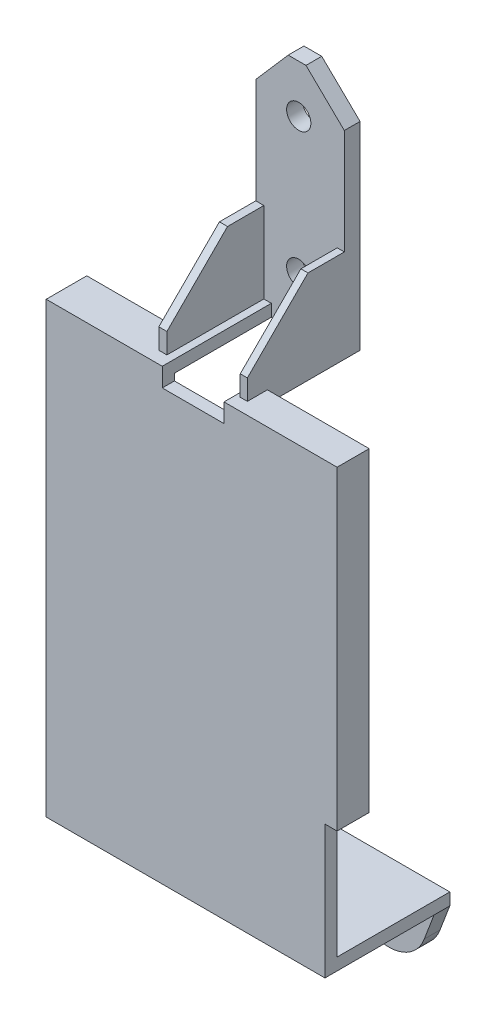
from build123d import *

# Parameters (mm, degrees)
ESQUISSE1_R             = 1
ESQUISSE1_RX            = 1
ESQUISSE1_RY            = 0.999955708
EXTRUSION1_DEPTH        = 9.3
EXTRUSION2_DEPTH        = 1
ENL_V_MAT_EXTRU_1_REACH = 53.345
ESQUISSE3_W             = 7.649288298
ESQUISSE3_H             = 26
ENL_V_MAT_EXTRU_2_REACH = 53.345
ESQUISSE4_W             = 6.951833508
ESQUISSE4_H             = 37
ENL_V_MAT_EXTRU_3_DEPTH = 9
CHANFREIN1_SIZE         = 5
ENL_V_MAT_EXTRU_4_DEPTH = 8


with BuildPart() as part:
    # Esquisse1 → Extrusion1 (new body)
    with BuildSketch(Plane.XY):
        with BuildLine():
            Line((22, 0), (22, 25))
            Line((22, 25), (0, 25))
            Line((0, 25), (0, -10))
            Line((0, -10), (22, -10))
            Line((22, -10), (22, -11))
            Line((22, -11), (21.190138404, -13.124684482))
            ThreePointArc((21.190138404, -13.124684482), (18.28157598, -15.158841298), (15.373013556, -13.124684482))
            Line((15.373013556, -13.124684482), (14.596979988, -11))
            Line((14.596979988, -11), (-1, -11))
            Line((-1, -11), (-1, 26))
            Line((-1, 26), (7.292692784, 26))
            Line((7.292692784, 26), (7.292692784, 41.355378005))
            Line((7.292692784, 41.355378005), (9.96388584, 44.427250018))
            Line((9.96388584, 44.427250018), (11.43304202, 44.427250018))
            Line((11.43304202, 44.427250018), (14.596979988, 41.355378005))
            Line((14.596979988, 41.355378005), (14.596979988, 26))
            Line((14.596979988, 26), (23, 26))
            Line((23, 26), (23, 0))
            Line((23, 0), (22, 0))
        make_face()
        with Locations((10.835624977, 29.282154136)):
            Circle(ESQUISSE1_R, mode=Mode.SUBTRACT)
        with Locations((10.835624977, 40.485887017)):
            Circle(ESQUISSE1_R, mode=Mode.SUBTRACT)
        with Locations(Location((18.28157598, -12.062342241), (0, 0, 0))):
            Ellipse(ESQUISSE1_RX, ESQUISSE1_RY, mode=Mode.SUBTRACT)
    extrude(amount=-EXTRUSION1_DEPTH)

    # Esquisse2 → Extrusion2 (add)
    with BuildSketch(Plane.XY):
        Polygon((22, 0), (23, 0), (23, 26), (-1, 26), (-1, -11), (22, -11), align=None)
    extrude(amount=EXTRUSION2_DEPTH)

    # Enlèv. mat.-Extru.1: up to this face of the body (flat: up to its plane)
    enl_v_mat_extru_1_end = Plane(part.part.faces().sort_by_distance((14.596979988, 33.677689002, -4.65))[0])
    # Esquisse3 → Enlèv. mat.-Extru.1 (cut, up to the picked face)
    with BuildSketch(Plane(origin=(23, 0, 0), x_dir=(0, 0, -1), z_dir=(1, 0, 0)), mode=Mode.PRIVATE) as enl_v_mat_extru_1_sk1:
        with Locations((5.475355851, 13)):
            Rectangle(ESQUISSE3_W, ESQUISSE3_H)
    enl_v_mat_extru_1_tool1 = split(extrude(enl_v_mat_extru_1_sk1.sketch, amount=-ENL_V_MAT_EXTRU_1_REACH, mode=Mode.PRIVATE), bisect_by=enl_v_mat_extru_1_end, keep=Keep.BOTH, mode=Mode.PRIVATE)
    add(enl_v_mat_extru_1_tool1.solids().sort_by(Axis((23, 13, -5.475356), (-1, 0, 0)))[0], mode=Mode.SUBTRACT)

    # Enlèv. mat.-Extru.2: up to this face of the body (flat: up to its plane)
    enl_v_mat_extru_2_end = Plane(part.part.faces().sort_by_distance((7.292692784, 33.677689002, -4.65))[0])
    # Esquisse4 → Enlèv. mat.-Extru.2 (cut, up to the picked face)
    with BuildSketch(Plane.ZY.offset(1), mode=Mode.PRIVATE) as enl_v_mat_extru_2_sk1:
        with Locations((-5.824083246, 7.5)):
            Rectangle(ESQUISSE4_W, ESQUISSE4_H)
    enl_v_mat_extru_2_tool1 = split(extrude(enl_v_mat_extru_2_sk1.sketch, amount=-ENL_V_MAT_EXTRU_2_REACH, mode=Mode.PRIVATE), bisect_by=enl_v_mat_extru_2_end, keep=Keep.BOTH, mode=Mode.PRIVATE)
    add(enl_v_mat_extru_2_tool1.solids().sort_by(Axis((-1, 7.5, -5.824083), (1, 0, 0)))[0], mode=Mode.SUBTRACT)

    # Esquisse5 → Enlèv. mat.-Extru.3 (cut)
    with BuildSketch(Plane.XY.offset(1)):
        Polygon((8.576662765, 24.450773838), (13.66977831, 24.450773838), (13.66977831, 26), (14.010433901, 26), (14.010433901, 32.678482304), (15.670246393, 32.678482304), (15.670246393, 45.814943355), (7.292692784, 45.814943355), (7.292692784, 32.678482304), (7.959479115, 32.678482304), (7.959479115, 26), (8.576662765, 26), align=None)
    extrude(amount=-ENL_V_MAT_EXTRU_3_DEPTH, mode=Mode.SUBTRACT)

    # Chanfrein1
    chanfrein1_edges = [part.edges().sort_by_distance(p)[0] for p in [
        (7.62608595, 32.678482304, 0),
        (14.303706945, 32.678482304, 0),
    ]]
    chamfer(chanfrein1_edges, length=CHANFREIN1_SIZE)

    # Esquisse6 → Enlèv. mat.-Extru.4 (cut)
    with BuildSketch(Plane.XY):
        with BuildLine():
            Line((22, -11), (14.596979988, -11))
            Line((14.596979988, -11), (15.373013556, -13.124684482))
            ThreePointArc((15.373013556, -13.124684482), (18.28157598, -15.158841298), (21.190138404, -13.124684482))
            Line((21.190138404, -13.124684482), (22, -11))
        make_face()
    extrude(amount=-ENL_V_MAT_EXTRU_4_DEPTH, mode=Mode.SUBTRACT)


solid = part.part
